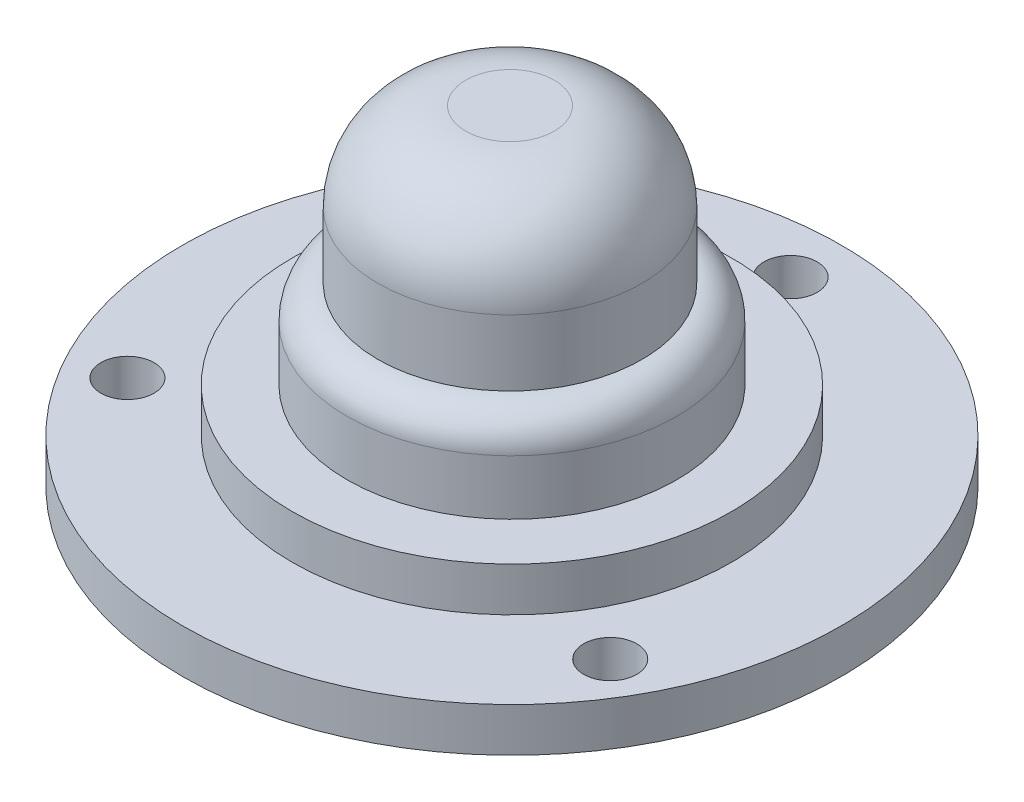
from build123d import *

# Parameters (mm, degrees)
SKETCH1_R           = 1.5
BOSS_EXTRUDE1_DEPTH = 0.2
SKETCH2_R           = 1
BOSS_EXTRUDE2_DEPTH = 0.2
SKETCH3_R           = 0.75
BOSS_EXTRUDE3_DEPTH = 0.4
FILLET1_R           = 0.15
SKETCH7_R           = 0.601293839
BOSS_EXTRUDE4_DEPTH = 0.7
FILLET2_R           = 0.4
SKETCH8_R           = 0.120832219
CUT_EXTRUDE1_DEPTH  = 0.7


with BuildPart() as part:
    # Sketch1 → Boss-Extrude1 (new body)
    with BuildSketch(Plane(origin=(0, 0, 0), x_dir=(1, 0, 0), z_dir=(0, 1, 0))):
        with Locations(Location((-0.771907226, 1.328636773, 0), (0, 0, 270))):
            Circle(SKETCH1_R)
    extrude(amount=BOSS_EXTRUDE1_DEPTH)

    # Sketch2 → Boss-Extrude2 (add)
    with BuildSketch(Plane(origin=(0, 0.2, 0), x_dir=(1, 0, 0), z_dir=(0, 1, 0))):
        with Locations(Location((-0.771907226, 1.328636773, 0), (0, 0, 270))):
            Circle(SKETCH2_R)
    extrude(amount=BOSS_EXTRUDE2_DEPTH)

    # Sketch3 → Boss-Extrude3 (add)
    with BuildSketch(Plane(origin=(0, 0.4, 0), x_dir=(1, 0, 0), z_dir=(0, 1, 0))):
        with Locations(Location((-0.771907226, 1.328636773, 0), (0, 0, 270))):
            Circle(SKETCH3_R)
    extrude(amount=BOSS_EXTRUDE3_DEPTH)

    # Fillet1
    fillet1_edges = [part.edges().sort_by_distance(p)[0] for p in [
        (-0.771907226, 0.8, -2.078636773),
    ]]
    fillet(fillet1_edges, radius=FILLET1_R)

    # Sketch7 → Boss-Extrude4 (add)
    with BuildSketch(Plane(origin=(0, 0.8, 0), x_dir=(1, 0, 0), z_dir=(0, 1, 0))):
        with Locations(Location((-0.776458573, 1.324432574, 0), (0, 0, 120.387457417))):
            Circle(SKETCH7_R)
    extrude(amount=BOSS_EXTRUDE4_DEPTH)

    # Fillet2
    fillet2_edges = [part.edges().sort_by_distance(p)[0] for p in [
        (-0.472297127, 1.5, -0.805741822),
    ]]
    fillet(fillet2_edges, radius=FILLET2_R)

    # Sketch8 → Cut-Extrude1 (cut)
    with BuildSketch(Plane(origin=(0, 0.2, 0), x_dir=(1, 0, 0), z_dir=(0, 1, 0))):
        with Locations(Location((-0.762097508, 2.587051024, 0), (0, 0, 270))):
            Circle(SKETCH8_R)
        with Locations(Location((0.333062694, 0.671048981, 0), (0, 0, 270))):
            Circle(SKETCH8_R)
        with Locations(Location((-1.87382385, 0.680613446, 0), (0, 0, 270))):
            Circle(SKETCH8_R)
    extrude(amount=-CUT_EXTRUDE1_DEPTH, mode=Mode.SUBTRACT)


solid = part.part
